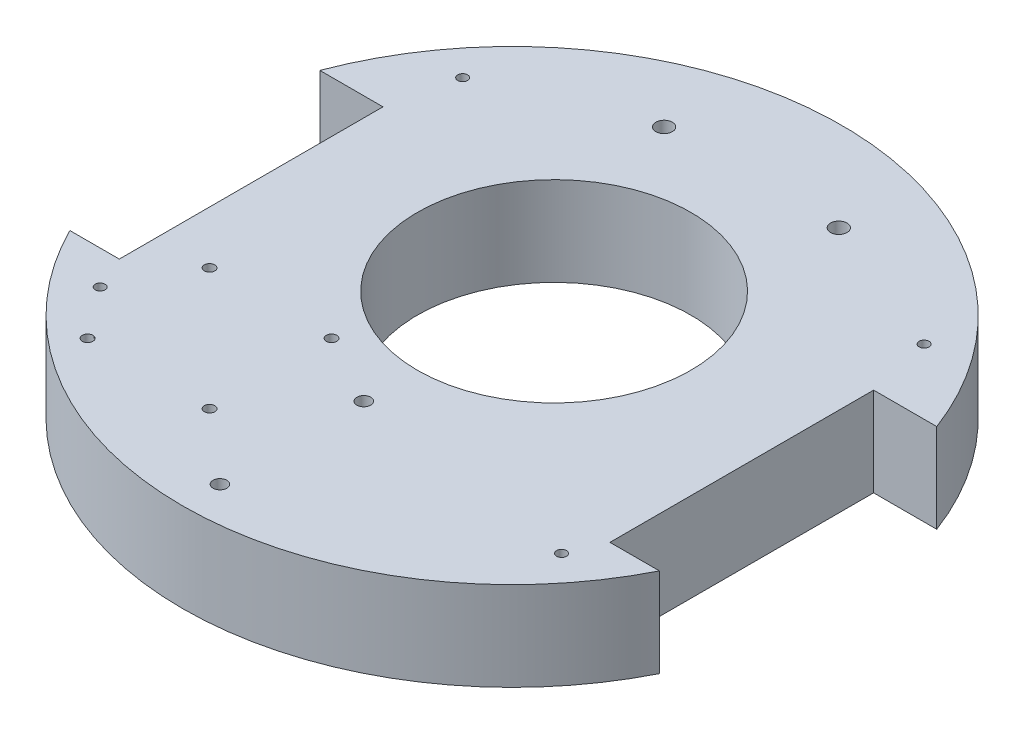
from build123d import *

# Parameters (mm, degrees)
SKETCH_2_R               = 100
EXTRUDE_1_DEPTH          = 27
CUT_EXTRUDE_1_DEPTH      = 144.975692393
CUT_EXTRUDE_1_DEPTH_BACK = 10
SKETCH_2_8_R             = 41.5
CUT_EXTRUDE_4_DEPTH      = 140.593830451
CUT_EXTRUDE_7_DEPTH      = 140.593830451
CUT_EXTRUDE_7_DEPTH_BACK = 10
SKETCH_2_11_R            = 2.1
CUT_EXTRUDE_8_DEPTH      = 140.593830451
CUT_EXTRUDE_8_DEPTH_BACK = 140.593830451
SKETCH_6_R               = 1.6
SKETCH_6_R_2             = 1.5
CUT_EXTRUDE_9_DEPTH      = 140.593830451
CUT_EXTRUDE_9_DEPTH_BACK = 140.593830451
SKETCH_7_R               = 2.5


with BuildPart() as part:
    # 草圖2 → 填料-伸長1 (new body)
    with BuildSketch(Plane(origin=(0, 0, 0), x_dir=(1, 0, 0), z_dir=(0, 1, 0))):
        Circle(SKETCH_2_R)
    extrude(amount=EXTRUDE_1_DEPTH)

    # 草圖2<5> → 除料-伸長1 (cut, two sides: drawn at the far end of the back side and taken through both)
    with BuildSketch(Plane(origin=(0, 0, 0), x_dir=(1, 0, 0), z_dir=(0, 1, 0)).offset(-CUT_EXTRUDE_1_DEPTH_BACK)):
        with BuildLine():
            Line((93.581181335, 35.25), (74.428393142, 35.25))
            Line((74.428393142, 35.25), (74.428393142, -44.75))
            Line((74.428393142, -44.75), (89.428393142, -44.75))
            ThreePointArc((89.428393142, -44.75), (99.86554004, -5.184005444), (93.581181335, 35.25))
        make_face()
        with BuildLine():
            Line((-74.428393142, 35.25), (-93.581181335, 35.25))
            ThreePointArc((-93.581181335, 35.25), (-99.86554004, -5.184005444), (-89.428393142, -44.75))
            Line((-89.428393142, -44.75), (-74.428393142, -44.75))
            Line((-74.428393142, -44.75), (-74.428393142, 35.25))
        make_face()
    extrude(amount=CUT_EXTRUDE_1_DEPTH + CUT_EXTRUDE_1_DEPTH_BACK, mode=Mode.SUBTRACT)

    # 草圖2<8> → 除料-伸長4 (cut, through all)
    with BuildSketch(Plane(origin=(0, 0, 0), x_dir=(1, 0, 0), z_dir=(0, 1, 0))):
        with Locations((0, 12.743545883)):
            Circle(SKETCH_2_8_R)
    extrude(amount=CUT_EXTRUDE_4_DEPTH, mode=Mode.SUBTRACT)

    # 草圖2<11> → 除料-伸長7 (cut, two sides: drawn at the far end of the back side and taken through both)
    with BuildSketch(Plane(origin=(0, 0, 0), x_dir=(1, 0, 0), z_dir=(0, 1, 0)).offset(-CUT_EXTRUDE_7_DEPTH_BACK)):
        with Locations((0, -45)):
            Circle(SKETCH_2_11_R)
        with Locations((0, -88.65)):
            Circle(SKETCH_2_11_R)
    extrude(amount=CUT_EXTRUDE_7_DEPTH + CUT_EXTRUDE_7_DEPTH_BACK, mode=Mode.SUBTRACT)

    # 草圖6 → 除料-伸長8 (cut, two sides: drawn at the far end of the back side and taken through both)
    with BuildSketch(Plane(origin=(0, 27, 0), x_dir=(1, 0, 0), z_dir=(0, 1, 0)).offset(-CUT_EXTRUDE_8_DEPTH_BACK)):
        with Locations((-58.41813564, -33.374946877)):
            Circle(SKETCH_6_R)
        with Locations((-21.41813564, -33.374946877)):
            Circle(SKETCH_6_R)
        with Locations((-58.41813564, -70.374946877)):
            Circle(SKETCH_6_R)
        with Locations((-21.41813564, -70.374946877)):
            Circle(SKETCH_6_R)
        with Locations((-70, -55)):
            Circle(SKETCH_6_R_2)
        with Locations((-70, 55)):
            Circle(SKETCH_6_R_2)
        with Locations((70, -55)):
            Circle(SKETCH_6_R_2)
        with Locations((70, 55)):
            Circle(SKETCH_6_R_2)
    extrude(amount=CUT_EXTRUDE_8_DEPTH + CUT_EXTRUDE_8_DEPTH_BACK, mode=Mode.SUBTRACT)

    # 草圖7 → 除料-伸長9 (cut, two sides: drawn at the far end of the back side and taken through both)
    with BuildSketch(Plane(origin=(0, 27, 0), x_dir=(1, 0, 0), z_dir=(0, 1, 0)).offset(-CUT_EXTRUDE_9_DEPTH_BACK)):
        with Locations((-26.5, 72.61491789)):
            Circle(SKETCH_7_R)
        with Locations((26.5, 72.61491789)):
            Circle(SKETCH_7_R)
    extrude(amount=CUT_EXTRUDE_9_DEPTH + CUT_EXTRUDE_9_DEPTH_BACK, mode=Mode.SUBTRACT)


solid = part.part
